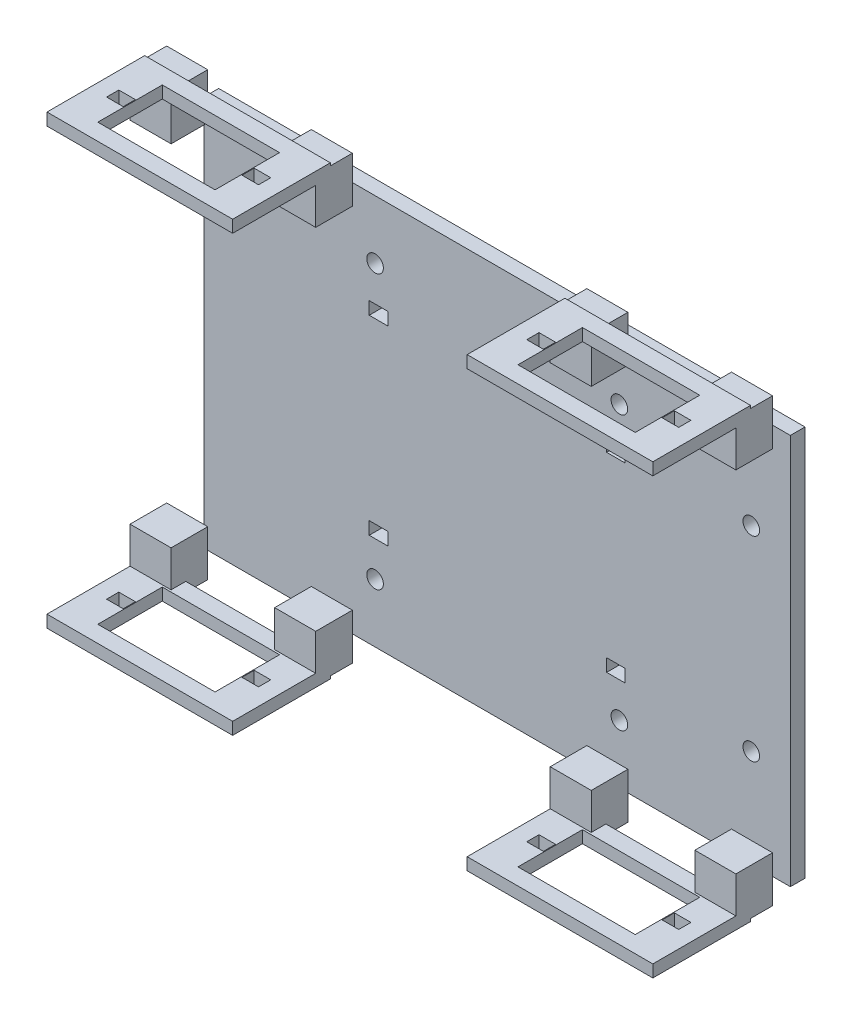
from build123d import *

# Parameters (mm, degrees)
SKETCH_1_W                       = 120
SKETCH_1_H                       = 80
DECK_120X80X3_DEPTH              = 3
FRAME_RIB_START                  = 3
SKETCH_2_W                       = 8.4
SKETCH_2_H                       = 9.4
FRAME_RIB_DEPTH                  = 7.5
EXTRUDE_START                    = 3
SKETCH_3_W                       = 8.4
SKETCH_3_H                       = 9.4
EXTRUDE_3_DEPTH                  = 7.5
MOUNT_UPRIGHT_START              = 10.5
SKETCH_4_W                       = 7
SKETCH_4_H                       = 2.5
MOUNT_UPRIGHT_DEPTH              = 17
EXTRUDE_START_2                  = 10.5
SKETCH_5_W                       = 7
SKETCH_5_H                       = 2.5
EXTRUDE_5_DEPTH                  = 17
MOUNT_LOWER_BEAM_START           = 7.5
SKETCH_6_W                       = 38
SKETCH_6_H                       = 2.5
MOUNT_LOWER_BEAM_DEPTH           = 3.4
MOUNT_UPPER_BEAM_START           = 24.1
SKETCH_7_W                       = 38
SKETCH_7_H                       = 2.5
MOUNT_UPPER_BEAM_DEPTH           = 3.4
SERVO_EAR_ADJUSTABLE_SLOTS_START = -46.5
SKETCH_8_W                       = 3.4
SKETCH_8_H                       = 2.5
SERVO_EAR_ADJUSTABLE_SLOTS_DEPTH = 4
SKETCH_9_W                       = 8.4
SKETCH_9_H                       = 9.4
EXTRUDE_8_DEPTH                  = 7.5
SKETCH_10_W                      = 8.4
SKETCH_10_H                      = 9.4
EXTRUDE_9_DEPTH                  = 7.5
SKETCH_11_W                      = 7
SKETCH_11_H                      = 2.5
EXTRUDE_10_DEPTH                 = 17
SKETCH_12_W                      = 7
SKETCH_12_H                      = 2.5
EXTRUDE_11_DEPTH                 = 17
EXTRUDE_START_3                  = 7.5
SKETCH_13_W                      = 38
SKETCH_13_H                      = 2.5
EXTRUDE_12_DEPTH                 = 3.4
EXTRUDE_START_4                  = 24.1
SKETCH_14_W                      = 38
SKETCH_14_H                      = 2.5
EXTRUDE_13_DEPTH                 = 3.4
CUT_EXTRUDE_START                = 42.5
SKETCH_15_W                      = 3.4
SKETCH_15_H                      = 2.5
CUT_EXTRUDE_2_DEPTH              = 4
SKETCH_16_W                      = 8.4
SKETCH_16_H                      = 9.4
EXTRUDE_14_DEPTH                 = 7.5
SKETCH_17_W                      = 8.4
SKETCH_17_H                      = 9.4
EXTRUDE_15_DEPTH                 = 7.5
SKETCH_18_W                      = 7
SKETCH_18_H                      = 2.5
EXTRUDE_16_DEPTH                 = 17
SKETCH_19_W                      = 7
SKETCH_19_H                      = 2.5
EXTRUDE_17_DEPTH                 = 17
SKETCH_20_W                      = 38
SKETCH_20_H                      = 2.5
EXTRUDE_18_DEPTH                 = 3.4
SKETCH_21_W                      = 38
SKETCH_21_H                      = 2.5
EXTRUDE_19_DEPTH                 = 3.4
CUT_EXTRUDE_START_2              = -46.5
SKETCH_22_W                      = 3.4
SKETCH_22_H                      = 2.5
CUT_EXTRUDE_3_DEPTH              = 4
SKETCH_23_W                      = 8.4
SKETCH_23_H                      = 9.4
EXTRUDE_20_DEPTH                 = 7.5
SKETCH_24_W                      = 8.4
SKETCH_24_H                      = 9.4
EXTRUDE_21_DEPTH                 = 7.5
SKETCH_25_W                      = 7
SKETCH_25_H                      = 2.5
EXTRUDE_22_DEPTH                 = 17
SKETCH_26_W                      = 7
SKETCH_26_H                      = 2.5
EXTRUDE_23_DEPTH                 = 17
SKETCH_27_W                      = 38
SKETCH_27_H                      = 2.5
EXTRUDE_24_DEPTH                 = 3.4
SKETCH_28_W                      = 38
SKETCH_28_H                      = 2.5
EXTRUDE_25_DEPTH                 = 3.4
SKETCH_29_W                      = 3.4
SKETCH_29_H                      = 2.5
CUT_EXTRUDE_4_DEPTH              = 4
M3_DECK_MOUNTING_HOLES_START     = -0.1
SKETCH_30_R                      = 1.7
M3_DECK_MOUNTING_HOLES_DEPTH     = 3.2
PCB_SCREW_ACCESS_START           = -0.1
SKETCH_31_W                      = 3.8
SKETCH_31_H                      = 2.6
PCB_SCREW_ACCESS_DEPTH           = 3.2


with BuildPart() as part:
    # 草图1 → Deck_120x80x3 (new body)
    with BuildSketch(Plane.XY):
        Rectangle(SKETCH_1_W, SKETCH_1_H)
    extrude(amount=DECK_120X80X3_DEPTH)

    # 草图2 → Frame_rib (add)
    with BuildSketch(Plane.XY.offset(FRAME_RIB_START)):
        with Locations((-63.45, -40.5)):
            Rectangle(SKETCH_2_W, SKETCH_2_H)
    extrude(amount=FRAME_RIB_DEPTH)

    # 草图3 → 凸台-拉伸3 (add)
    with BuildSketch(Plane.XY.offset(EXTRUDE_START)):
        with Locations((-33.85, -40.5)):
            Rectangle(SKETCH_3_W, SKETCH_3_H)
    extrude(amount=EXTRUDE_3_DEPTH)

    # 草图4 → Mount_upright (add)
    with BuildSketch(Plane.XY.offset(MOUNT_UPRIGHT_START)):
        with Locations((-64.15, -44.5)):
            Rectangle(SKETCH_4_W, SKETCH_4_H)
    extrude(amount=MOUNT_UPRIGHT_DEPTH)

    # 草图5 → 凸台-拉伸5 (add)
    with BuildSketch(Plane.XY.offset(EXTRUDE_START_2)):
        with Locations((-33.15, -44.5)):
            Rectangle(SKETCH_5_W, SKETCH_5_H)
    extrude(amount=EXTRUDE_5_DEPTH)

    # 草图6 → Mount_lower_beam (add)
    with BuildSketch(Plane.XY.offset(MOUNT_LOWER_BEAM_START)):
        with Locations((-48.65, -44.5)):
            Rectangle(SKETCH_6_W, SKETCH_6_H)
    extrude(amount=MOUNT_LOWER_BEAM_DEPTH)

    # 草图7 → Mount_upper_beam (add)
    with BuildSketch(Plane.XY.offset(MOUNT_UPPER_BEAM_START)):
        with Locations((-48.65, -44.5)):
            Rectangle(SKETCH_7_W, SKETCH_7_H)
    extrude(amount=MOUNT_UPPER_BEAM_DEPTH)

    # 草图8 → Servo_ear_adjustable_slots (cut)
    with BuildSketch(Plane(origin=(0, 0, 0), x_dir=(1, 0, 0), z_dir=(0, 1, 0)).offset(SERVO_EAR_ADJUSTABLE_SLOTS_START)):
        with Locations((-62.5, -17.5)):
            Rectangle(SKETCH_8_W, SKETCH_8_H)
        with Locations((-34.8, -17.5)):
            Rectangle(SKETCH_8_W, SKETCH_8_H)
    extrude(amount=SERVO_EAR_ADJUSTABLE_SLOTS_DEPTH, mode=Mode.SUBTRACT)

    # 草图9 → 凸台-拉伸8 (add)
    with BuildSketch(Plane.XY.offset(EXTRUDE_START)):
        with Locations((-63.45, 40.5)):
            Rectangle(SKETCH_9_W, SKETCH_9_H)
    extrude(amount=EXTRUDE_8_DEPTH)

    # 草图10 → 凸台-拉伸9 (add)
    with BuildSketch(Plane.XY.offset(EXTRUDE_START)):
        with Locations((-33.85, 40.5)):
            Rectangle(SKETCH_10_W, SKETCH_10_H)
    extrude(amount=EXTRUDE_9_DEPTH)

    # 草图11 → 凸台-拉伸10 (add)
    with BuildSketch(Plane.XY.offset(EXTRUDE_START_2)):
        with Locations((-64.15, 44.5)):
            Rectangle(SKETCH_11_W, SKETCH_11_H)
    extrude(amount=EXTRUDE_10_DEPTH)

    # 草图12 → 凸台-拉伸11 (add)
    with BuildSketch(Plane.XY.offset(EXTRUDE_START_2)):
        with Locations((-33.15, 44.5)):
            Rectangle(SKETCH_12_W, SKETCH_12_H)
    extrude(amount=EXTRUDE_11_DEPTH)

    # 草图13 → 凸台-拉伸12 (add)
    with BuildSketch(Plane.XY.offset(EXTRUDE_START_3)):
        with Locations((-48.65, 44.5)):
            Rectangle(SKETCH_13_W, SKETCH_13_H)
    extrude(amount=EXTRUDE_12_DEPTH)

    # 草图14 → 凸台-拉伸13 (add)
    with BuildSketch(Plane.XY.offset(EXTRUDE_START_4)):
        with Locations((-48.65, 44.5)):
            Rectangle(SKETCH_14_W, SKETCH_14_H)
    extrude(amount=EXTRUDE_13_DEPTH)

    # 草图15 → 切除-拉伸2 (cut)
    with BuildSketch(Plane(origin=(0, 0, 0), x_dir=(1, 0, 0), z_dir=(0, 1, 0)).offset(CUT_EXTRUDE_START)):
        with Locations((-62.5, -17.5)):
            Rectangle(SKETCH_15_W, SKETCH_15_H)
        with Locations((-34.8, -17.5)):
            Rectangle(SKETCH_15_W, SKETCH_15_H)
    extrude(amount=CUT_EXTRUDE_2_DEPTH, mode=Mode.SUBTRACT)

    # 草图16 → 凸台-拉伸14 (add)
    with BuildSketch(Plane.XY.offset(EXTRUDE_START)):
        with Locations((22.55, -40.5)):
            Rectangle(SKETCH_16_W, SKETCH_16_H)
    extrude(amount=EXTRUDE_14_DEPTH)

    # 草图17 → 凸台-拉伸15 (add)
    with BuildSketch(Plane.XY.offset(EXTRUDE_START)):
        with Locations((52.15, -40.5)):
            Rectangle(SKETCH_17_W, SKETCH_17_H)
    extrude(amount=EXTRUDE_15_DEPTH)

    # 草图18 → 凸台-拉伸16 (add)
    with BuildSketch(Plane.XY.offset(EXTRUDE_START_2)):
        with Locations((21.85, -44.5)):
            Rectangle(SKETCH_18_W, SKETCH_18_H)
    extrude(amount=EXTRUDE_16_DEPTH)

    # 草图19 → 凸台-拉伸17 (add)
    with BuildSketch(Plane.XY.offset(EXTRUDE_START_2)):
        with Locations((52.85, -44.5)):
            Rectangle(SKETCH_19_W, SKETCH_19_H)
    extrude(amount=EXTRUDE_17_DEPTH)

    # 草图20 → 凸台-拉伸18 (add)
    with BuildSketch(Plane.XY.offset(EXTRUDE_START_3)):
        with Locations((37.35, -44.5)):
            Rectangle(SKETCH_20_W, SKETCH_20_H)
    extrude(amount=EXTRUDE_18_DEPTH)

    # 草图21 → 凸台-拉伸19 (add)
    with BuildSketch(Plane.XY.offset(EXTRUDE_START_4)):
        with Locations((37.35, -44.5)):
            Rectangle(SKETCH_21_W, SKETCH_21_H)
    extrude(amount=EXTRUDE_19_DEPTH)

    # 草图22 → 切除-拉伸3 (cut)
    with BuildSketch(Plane(origin=(0, 0, 0), x_dir=(1, 0, 0), z_dir=(0, 1, 0)).offset(CUT_EXTRUDE_START_2)):
        with Locations((23.5, -17.5)):
            Rectangle(SKETCH_22_W, SKETCH_22_H)
        with Locations((51.2, -17.5)):
            Rectangle(SKETCH_22_W, SKETCH_22_H)
    extrude(amount=CUT_EXTRUDE_3_DEPTH, mode=Mode.SUBTRACT)

    # 草图23 → 凸台-拉伸20 (add)
    with BuildSketch(Plane.XY.offset(EXTRUDE_START)):
        with Locations((22.55, 40.5)):
            Rectangle(SKETCH_23_W, SKETCH_23_H)
    extrude(amount=EXTRUDE_20_DEPTH)

    # 草图24 → 凸台-拉伸21 (add)
    with BuildSketch(Plane.XY.offset(EXTRUDE_START)):
        with Locations((52.15, 40.5)):
            Rectangle(SKETCH_24_W, SKETCH_24_H)
    extrude(amount=EXTRUDE_21_DEPTH)

    # 草图25 → 凸台-拉伸22 (add)
    with BuildSketch(Plane.XY.offset(EXTRUDE_START_2)):
        with Locations((21.85, 44.5)):
            Rectangle(SKETCH_25_W, SKETCH_25_H)
    extrude(amount=EXTRUDE_22_DEPTH)

    # 草图26 → 凸台-拉伸23 (add)
    with BuildSketch(Plane.XY.offset(EXTRUDE_START_2)):
        with Locations((52.85, 44.5)):
            Rectangle(SKETCH_26_W, SKETCH_26_H)
    extrude(amount=EXTRUDE_23_DEPTH)

    # 草图27 → 凸台-拉伸24 (add)
    with BuildSketch(Plane.XY.offset(EXTRUDE_START_3)):
        with Locations((37.35, 44.5)):
            Rectangle(SKETCH_27_W, SKETCH_27_H)
    extrude(amount=EXTRUDE_24_DEPTH)

    # 草图28 → 凸台-拉伸25 (add)
    with BuildSketch(Plane.XY.offset(EXTRUDE_START_4)):
        with Locations((37.35, 44.5)):
            Rectangle(SKETCH_28_W, SKETCH_28_H)
    extrude(amount=EXTRUDE_25_DEPTH)

    # 草图29 → 切除-拉伸4 (cut)
    with BuildSketch(Plane(origin=(0, 0, 0), x_dir=(1, 0, 0), z_dir=(0, 1, 0)).offset(CUT_EXTRUDE_START)):
        with Locations((23.5, -17.5)):
            Rectangle(SKETCH_29_W, SKETCH_29_H)
        with Locations((51.2, -17.5)):
            Rectangle(SKETCH_29_W, SKETCH_29_H)
    extrude(amount=CUT_EXTRUDE_4_DEPTH, mode=Mode.SUBTRACT)

    # 草图30 → M3_deck_mounting_holes (cut)
    with BuildSketch(Plane.XY.offset(M3_DECK_MOUNTING_HOLES_START)):
        with Locations((-25, -28)):
            Circle(SKETCH_30_R)
        with Locations((-25, 28)):
            Circle(SKETCH_30_R)
        with Locations((25, -28)):
            Circle(SKETCH_30_R)
        with Locations((25, 28)):
            Circle(SKETCH_30_R)
        with Locations((52, -20)):
            Circle(SKETCH_30_R)
        with Locations((52, 20)):
            Circle(SKETCH_30_R)
    extrude(amount=M3_DECK_MOUNTING_HOLES_DEPTH, mode=Mode.SUBTRACT)

    # 草图31 → PCB_screw_access (cut)
    with BuildSketch(Plane.XY.offset(PCB_SCREW_ACCESS_START)):
        with Locations((-24.3, -19.5)):
            Rectangle(SKETCH_31_W, SKETCH_31_H)
        with Locations((-24.3, 19.5)):
            Rectangle(SKETCH_31_W, SKETCH_31_H)
        with Locations((24.3, -19.5)):
            Rectangle(SKETCH_31_W, SKETCH_31_H)
        with Locations((24.3, 19.5)):
            Rectangle(SKETCH_31_W, SKETCH_31_H)
    extrude(amount=PCB_SCREW_ACCESS_DEPTH, mode=Mode.SUBTRACT)


solid = part.part
